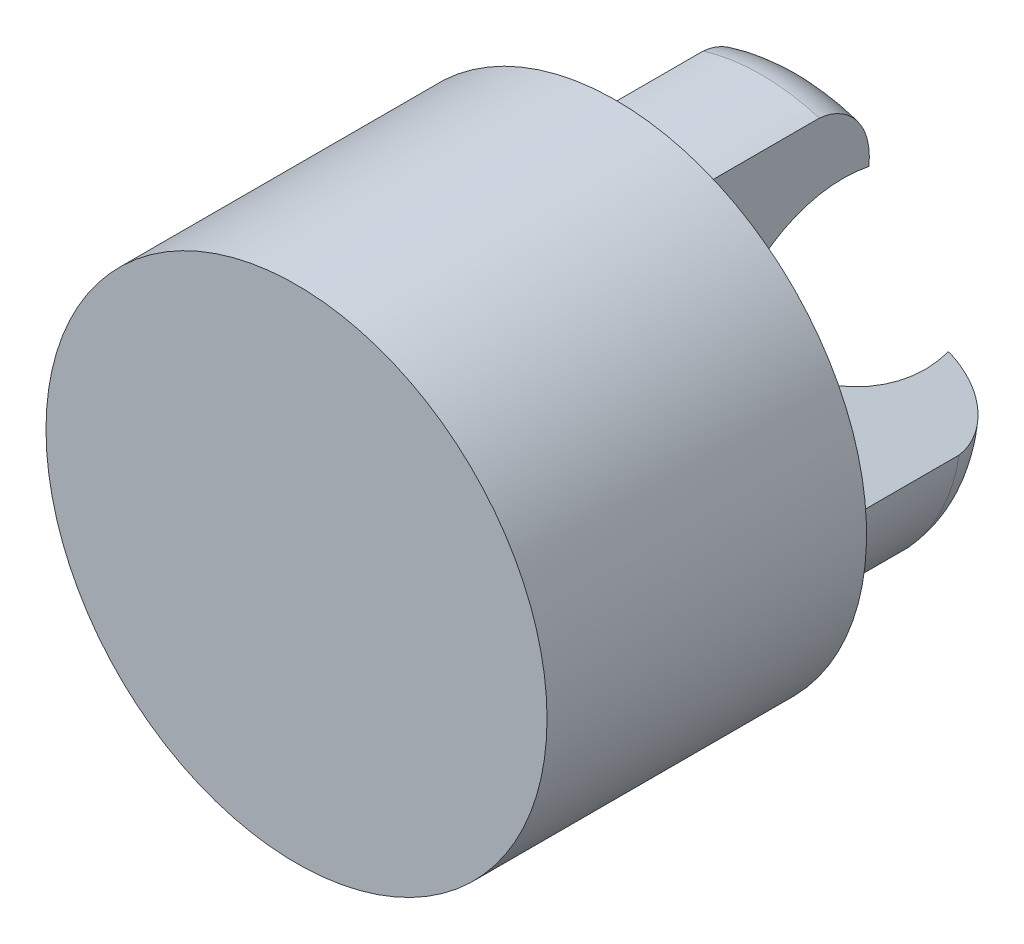
from build123d import *

# Parameters (mm, degrees)
CORTE_EXTRUS_O1_DEPTH    = 12.838758968
ESBO_O4_R                = 1.6
RESSALTO_EXTRUS_O1_DEPTH = 4
ESBO_O5_W                = 57.361933027
ESBO_O5_H                = 29.217059345
ESBO_O5_R                = 10
CORTE_EXTRUS_O2_DEPTH    = 10
ESBO_O6_R                = 10
ESBO_O6_R_2              = 8.625
CORTE_EXTRUS_O3_DEPTH    = 10
ESBO_O8_R                = 8.625
RESSALTO_EXTRUS_O2_DEPTH = 7


with BuildPart() as part:
    # Esboço1 → Revolução1 (revolve)
    with BuildSketch(Plane(origin=(0, 0, 0), x_dir=(1, 0, 0), z_dir=(0, 1, 0))):
        with BuildLine():
            Line((0, 0), (6.891534421, 0))
            Line((6.891534421, 0), (6.891534421, 5))
            ThreePointArc((6.891534421, 5), (6.180613943, 6.309516298), (4.743586175, 6.703460527))
            ThreePointArc((4.743586175, 6.703460527), (3.710745118, 2.736851933), (0, 0.995842151))
            Line((0, 0.995842151), (0, 0))
        make_face()
    revolve(axis=Axis((0, 0, 0), (0, 0, -1)))

    # Esboço3 → Corte-extrusão1 (cut, through all)
    with BuildSketch(Plane.XY):
        with BuildLine():
            Line((-2, 19.326317369), (-2, 1.734101615))
            Line((-2, 1.734101615), (-17.937282026, -7.467292453))
            ThreePointArc((-17.937282026, -7.467292453), (-16.698748021, 9.932691356), (-2, 19.326317369))
        make_face()
        with BuildLine():
            Line((2, 19.326317369), (2, 1.734101615))
            Line((2, 1.734101615), (17.937282026, -7.467292453))
            ThreePointArc((17.937282026, -7.467292453), (16.698748021, 9.932691356), (2, 19.326317369))
        make_face()
        with BuildLine():
            Line((0, -1.73), (-16.027252382, -10.983338477))
            ThreePointArc((-16.027252382, -10.983338477), (0, -19.429527607), (16.027252382, -10.983338477))
            Line((16.027252382, -10.983338477), (0, -1.73))
        make_face()
    extrude(amount=-CORTE_EXTRUS_O1_DEPTH, mode=Mode.SUBTRACT)

    # Esboço4 → Ressalto-extrusão1 (add)
    with BuildSketch(Plane.XY):
        with BuildLine():
            ThreePointArc((-6.64, -7.477325725), (0, -10), (6.64, -7.477325725))
            ThreePointArc((6.64, -7.477325725), (12.553949294, -4.249302623), (19.284210526, -3.935434592))
            ThreePointArc((19.284210526, -3.935434592), (24, 0), (19.284210526, 3.935434592))
            ThreePointArc((19.284210526, 3.935434592), (12.553949294, 4.249302623), (6.64, 7.477325725))
            ThreePointArc((6.64, 7.477325725), (0, 10), (-6.64, 7.477325725))
            ThreePointArc((-6.64, 7.477325725), (-12.553949294, 4.249302623), (-19.284210526, 3.935434592))
            ThreePointArc((-19.284210526, 3.935434592), (-24, 0), (-19.284210526, -3.935434592))
            ThreePointArc((-19.284210526, -3.935434592), (-12.553949294, -4.249302623), (-6.64, -7.477325725))
        make_face()
        with Locations((20, 0)):
            Circle(ESBO_O4_R, mode=Mode.SUBTRACT)
        with Locations((-20, 0)):
            Circle(ESBO_O4_R, mode=Mode.SUBTRACT)
    extrude(amount=RESSALTO_EXTRUS_O1_DEPTH)

    # Esboço5 → Corte-extrusão2 (cut)
    with BuildSketch(Plane(origin=(0, 0, 0), x_dir=(-1, 0, 0), z_dir=(0, 0, -1))):
        with Locations((1.250708993, 0.03640394)):
            Rectangle(ESBO_O5_W, ESBO_O5_H)
        with Locations(Location((0, 0, 0), (0, 0, 180))):
            Circle(ESBO_O5_R, mode=Mode.SUBTRACT)
    extrude(amount=-CORTE_EXTRUS_O2_DEPTH, mode=Mode.SUBTRACT)

    # Esboço6 → Corte-extrusão3 (cut)
    with BuildSketch(Plane(origin=(0, 0, 0), x_dir=(-1, 0, 0), z_dir=(0, 0, -1))):
        Circle(ESBO_O6_R)
        Circle(ESBO_O6_R_2, mode=Mode.SUBTRACT)
    extrude(amount=-CORTE_EXTRUS_O3_DEPTH, mode=Mode.SUBTRACT)

    # Esboço8 → Ressalto-extrusão2 (add)
    with BuildSketch(Plane.XY.offset(4)):
        with Locations(Location((0, 0, 0), (0, 0, 180))):
            Circle(ESBO_O8_R)
    extrude(amount=RESSALTO_EXTRUS_O2_DEPTH)


solid = part.part
